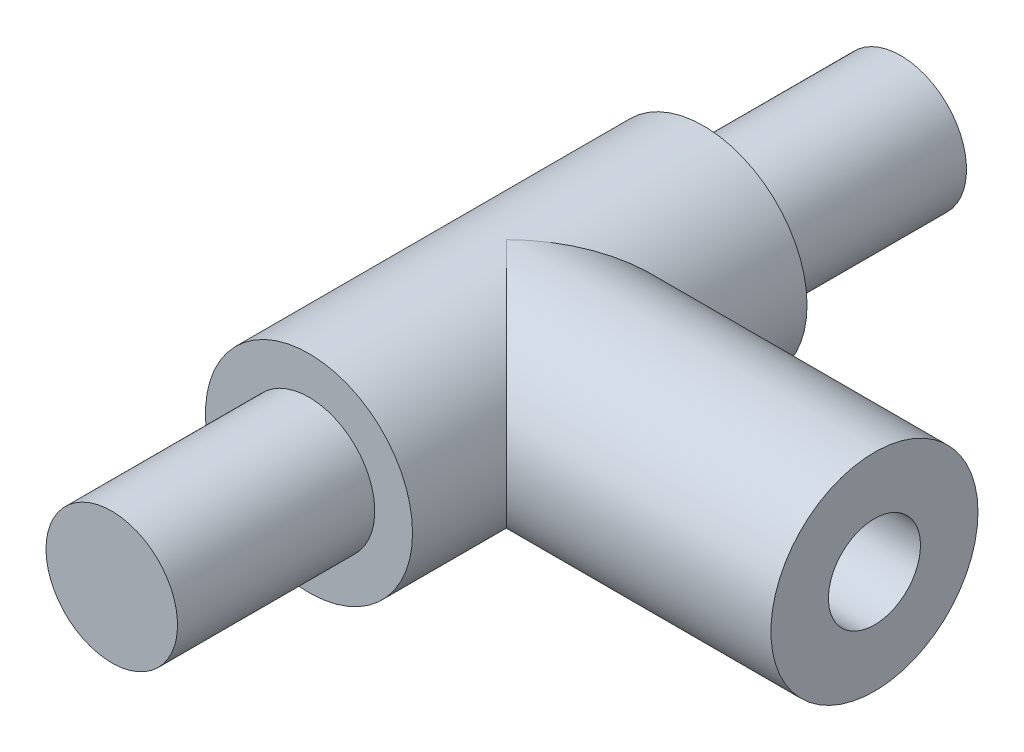
from build123d import *

# Parameters (mm, degrees)
SKETCH1_R           = 5
BOSS_EXTRUDE1_DEPTH = 9.525
SKETCH5_R           = 3.175
BOSS_EXTRUDE4_DEPTH = 19.05
SKETCH6_R           = 5
BOSS_EXTRUDE5_DEPTH = 17.78
SKETCH7_R           = 2.2225
CUT_EXTRUDE1_DEPTH  = 12.7


with BuildPart() as part:
    # Sketch1 → Boss-Extrude1 (new, symmetric)
    with BuildSketch(Plane.XY):
        with Locations(Location((0, 0, 0), (0, 0, 180))):
            Circle(SKETCH1_R)
    extrude(amount=BOSS_EXTRUDE1_DEPTH, both=True)

    # Sketch5 → Boss-Extrude4 (add, symmetric)
    with BuildSketch(Plane.XY):
        with Locations(Location((0, 0, 0), (0, 0, 180))):
            Circle(SKETCH5_R)
    extrude(amount=BOSS_EXTRUDE4_DEPTH, both=True)

    # Sketch6 → Boss-Extrude5 (add)
    with BuildSketch(Plane(origin=(0, 0, 0), x_dir=(0, 0, -1), z_dir=(1, 0, 0))):
        Circle(SKETCH6_R)
    extrude(amount=BOSS_EXTRUDE5_DEPTH)

    # Sketch7 → Cut-Extrude1 (cut)
    with BuildSketch(Plane(origin=(17.78, 0, 0), x_dir=(0, 0, -1), z_dir=(1, 0, 0))):
        Circle(SKETCH7_R)
    extrude(amount=-CUT_EXTRUDE1_DEPTH, mode=Mode.SUBTRACT)


solid = part.part
